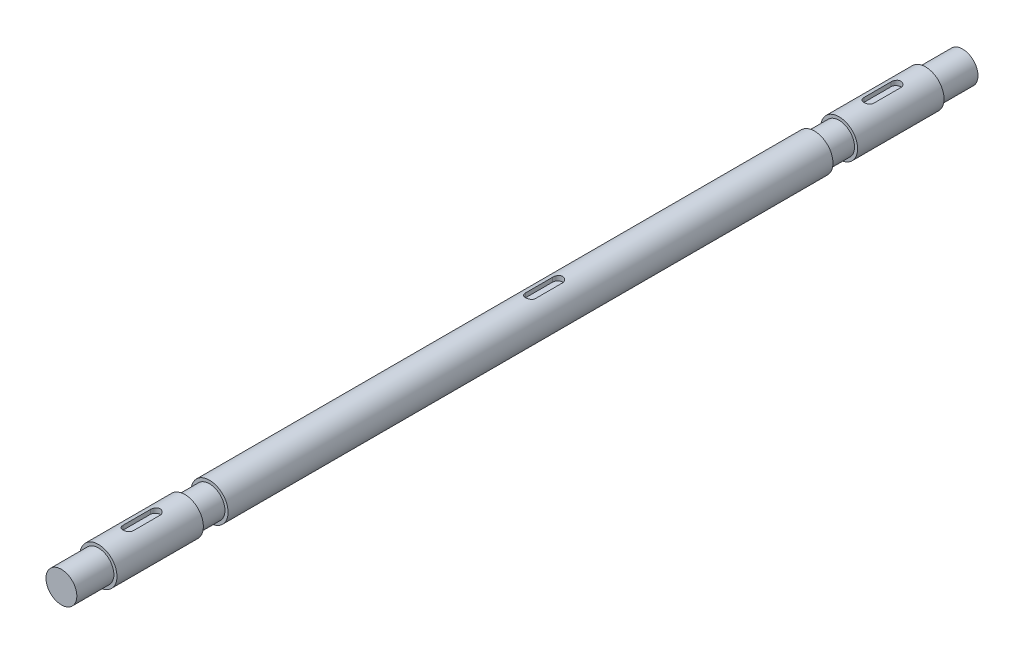
from build123d import *

# Parameters (mm, degrees)
CUT_EXTRUDE1_START = 11
CUT_EXTRUDE1_DEPTH = 690.321354808


with BuildPart() as part:
    # Sketch1 → Revolve1 (revolve)
    with BuildSketch(Plane(origin=(0, 0, 0), x_dir=(0, 0, -1), z_dir=(1, 0, 0)), mode=Mode.PRIVATE) as revolve1_sk:
        Polygon((0, 15), (70, 15), (70, 12.5), (90, 12.5), (90, 15), (580, 15), (580, 12.5), (600, 12.5), (600, 15), (670, 15), (670, 12.5), (700, 12.5), (700, 0), (-30, 0), (-30, 12.5), (0, 12.5), align=None)
    revolve(revolve1_sk.sketch.rotate(Axis((0, 0, 91.723358082), (0, 0, -1)), 90), axis=Axis((0, 0, 91.723358082), (0, 0, -1)))

    # Sketch2 → Cut-Extrude1 (cut, through all)
    with BuildSketch(Plane(origin=(0, 0, 0), x_dir=(1, 0, 0), z_dir=(0, 1, 0)).offset(CUT_EXTRUDE1_START)):
        with BuildLine():
            Line((4, 646), (4, 624))
            ThreePointArc((4, 624), (0, 620), (-4, 624))
            Line((-4, 624), (-4, 646))
            ThreePointArc((-4, 646), (0, 650), (4, 646))
        make_face()
        with BuildLine():
            Line((4, 372), (4, 350))
            ThreePointArc((4, 350), (0, 346), (-4, 350))
            Line((-4, 350), (-4, 372))
            ThreePointArc((-4, 372), (0, 376), (4, 372))
        make_face()
        with BuildLine():
            Line((4, 46), (4, 24))
            ThreePointArc((4, 24), (0, 20), (-4, 24))
            Line((-4, 24), (-4, 46))
            ThreePointArc((-4, 46), (0, 50), (4, 46))
        make_face()
    extrude(amount=CUT_EXTRUDE1_DEPTH, mode=Mode.SUBTRACT)


solid = part.part
